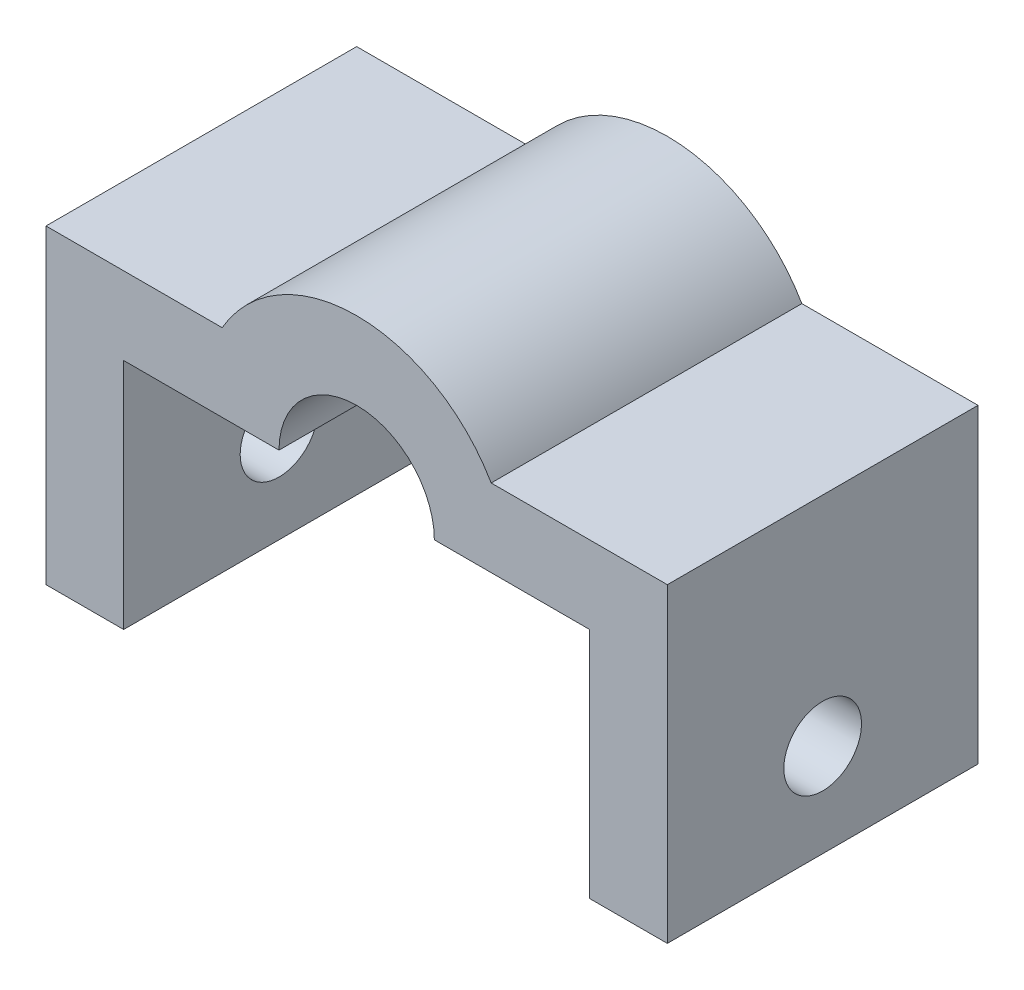
from build123d import *

# Parameters (mm, degrees)
BOSS_EXTRUDE1_DEPTH = 12.7
SKETCH2_R           = 1.5875
CUT_EXTRUDE1_DEPTH  = 76.2


with BuildPart() as part:
    # Sketch1 → Boss-Extrude1 (new body)
    with BuildSketch(Plane.XY):
        with BuildLine():
            Line((0, 0), (0, 9.525))
            Line((0, 9.525), (6.35, 9.525))
            ThreePointArc((6.35, 9.525), (9.525, 12.7), (12.7, 9.525))
            Line((12.7, 9.525), (19.05, 9.525))
            Line((19.05, 9.525), (19.05, 0))
            Line((19.05, 0), (22.225, 0))
            Line((22.225, 0), (22.225, 12.7))
            Line((22.225, 12.7), (15.024261314, 12.7))
            ThreePointArc((15.024261314, 12.7), (9.525, 15.875), (4.025738686, 12.7))
            Line((4.025738686, 12.7), (-3.175, 12.7))
            Line((-3.175, 12.7), (-3.175, 0))
            Line((-3.175, 0), (0, 0))
        make_face()
    extrude(amount=BOSS_EXTRUDE1_DEPTH)

    # Sketch2 → Cut-Extrude1 (cut)
    with BuildSketch(Plane.ZY.offset(3.175)):
        with Locations((6.35, 3.81)):
            Circle(SKETCH2_R)
    extrude(amount=-CUT_EXTRUDE1_DEPTH, mode=Mode.SUBTRACT)


solid = part.part
